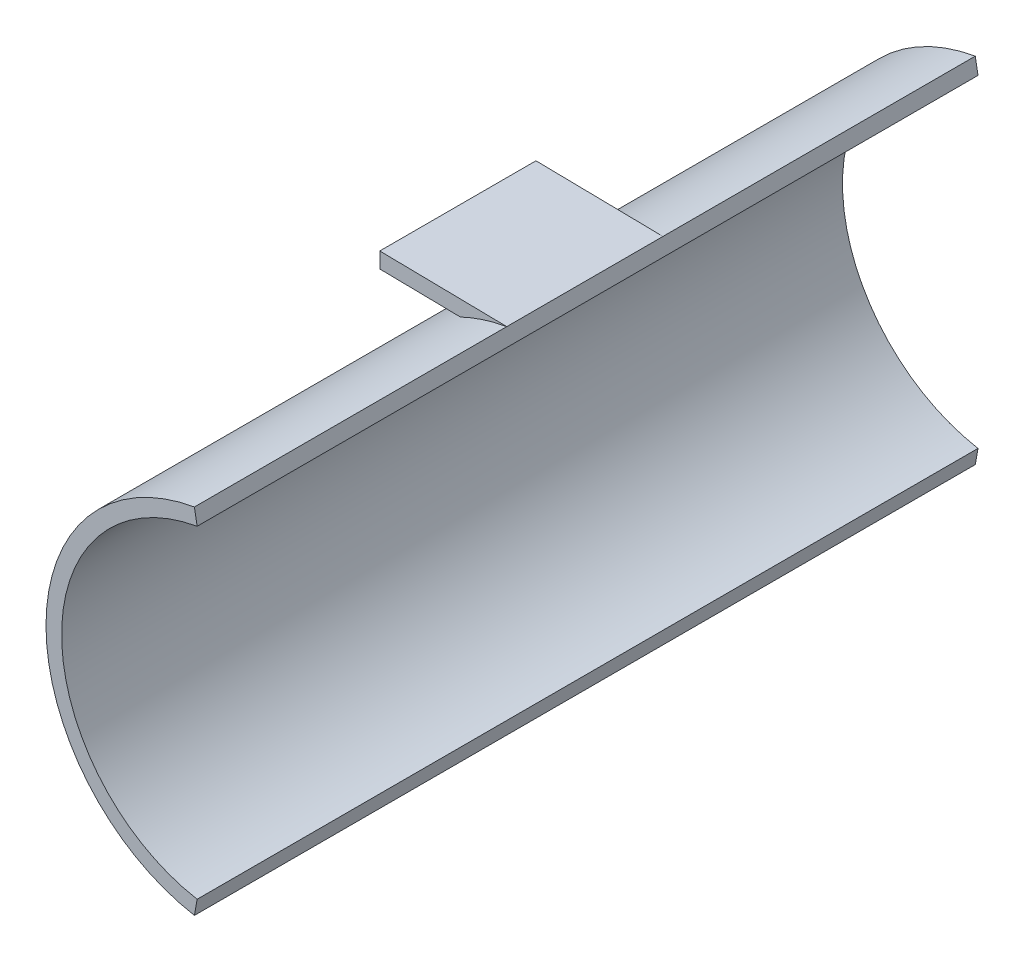
from build123d import *

# Parameters (mm, degrees)
EXTRUDE_1_DEPTH = 50
EXTRUDE_2_DEPTH = 10


with BuildPart() as part:
    # 草图1 → 凸台-拉伸1 (new, symmetric)
    with BuildSketch(Plane.XY):
        with BuildLine():
            Line((-3.646611731, 20.680962813), (-3.993908086, 22.650578319))
            ThreePointArc((-3.993908086, 22.650578319), (-23, 0), (-3.993908086, -22.650578319))
            Line((-3.993908086, -22.650578319), (-3.646611731, -20.680962813))
            ThreePointArc((-3.646611731, -20.680962813), (-21, 0), (-3.646611731, 20.680962813))
        make_face()
    extrude(amount=EXTRUDE_1_DEPTH, both=True)

    # 草图2 → 凸台-拉伸2 (add, symmetric)
    with BuildSketch(Plane.XY):
        with BuildLine():
            Line((-3.993908086, 22.650578319), (-20.254671357, 22.911623668))
            Line((-20.254671357, 22.911623668), (-20.254671357, 20.911623668))
            Line((-20.254671357, 20.911623668), (-9.930184633, 20.745877498))
            ThreePointArc((-9.930184633, 20.745877498), (-7.026881301, 21.900295413), (-3.993908086, 22.650578319))
        make_face()
    extrude(amount=EXTRUDE_2_DEPTH, both=True)


solid = part.part
